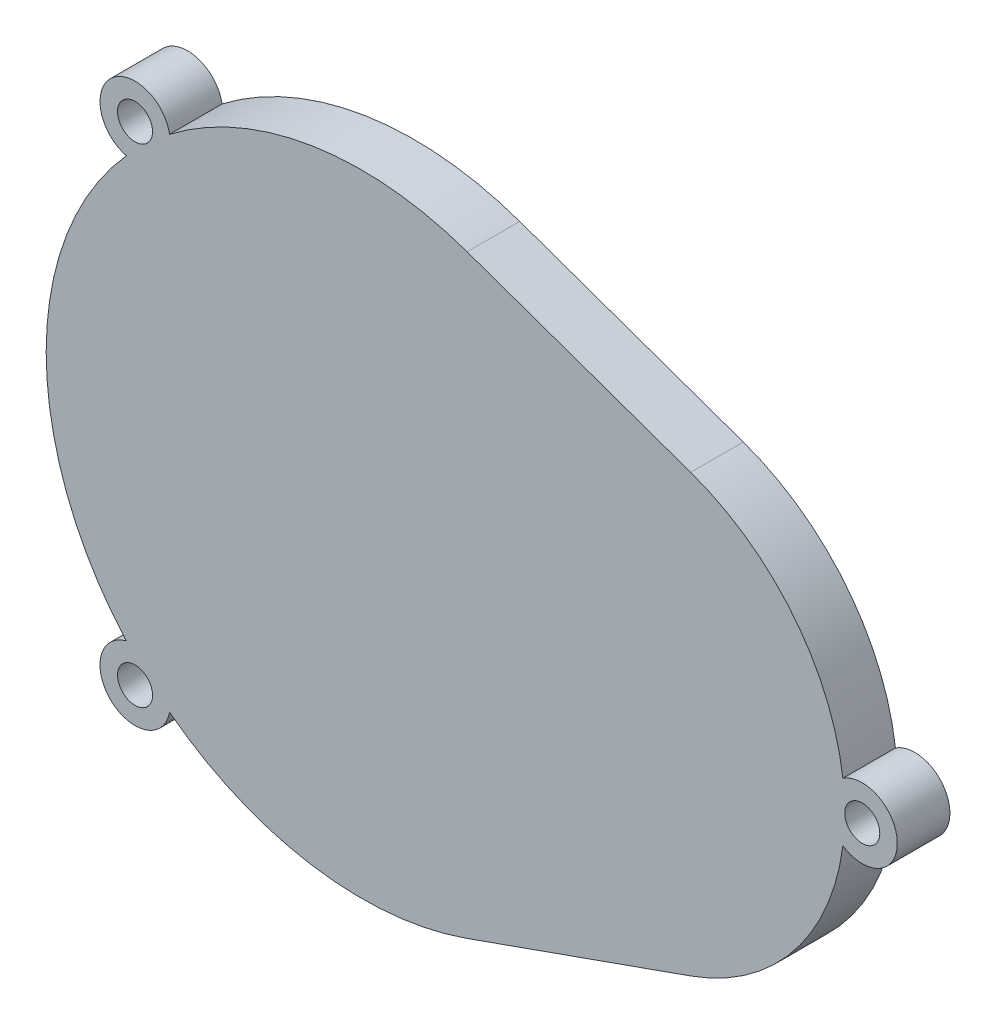
from build123d import *

# Parameters (mm, degrees)
SKETCH1_R           = 0.5
BOSS_EXTRUDE1_DEPTH = 1.5


with BuildPart() as part:
    # Sketch1 → Boss-Extrude1 (new body)
    with BuildSketch(Plane.XY):
        with BuildLine():
            Line((12.364948684, 9.687701301), (5.987177096, 11.949653903))
            ThreePointArc((5.987177096, 11.949653903), (1.571990001, 12.356697641), (-2.501744354, 10.606197685))
            ThreePointArc((-2.501744354, 10.606197685), (-4.166324297, 11.161284148), (-3.73571139, 9.4602492))
            ThreePointArc((-3.73571139, 9.4602492), (-6.02117945, 3.467331645), (-3.73571139, -2.525585911))
            ThreePointArc((-3.73571139, -2.525585911), (-4.166324297, -4.226620858), (-2.501744354, -3.671534395))
            ThreePointArc((-2.501744354, -3.671534395), (1.571990001, -5.422034351), (5.987177096, -5.014990613))
            Line((5.987177096, -5.014990613), (12.364948684, -2.753038011))
            ThreePointArc((12.364948684, -2.753038011), (15.297909656, -0.673895607), (16.706003649, 2.634028895))
            ThreePointArc((16.706003649, 2.634028895), (18.25882055, 3.467331645), (16.706003649, 4.300634395))
            ThreePointArc((16.706003649, 4.300634395), (15.297909656, 7.608558897), (12.364948684, 9.687701301))
        make_face()
        with Locations((-3.485834311, 10.428526767)):
            Circle(SKETCH1_R, mode=Mode.SUBTRACT)
        with Locations((-3.485834311, -3.493863477)):
            Circle(SKETCH1_R, mode=Mode.SUBTRACT)
        with Locations((17.25882055, 3.467331645)):
            Circle(SKETCH1_R, mode=Mode.SUBTRACT)
    extrude(amount=BOSS_EXTRUDE1_DEPTH)


solid = part.part
